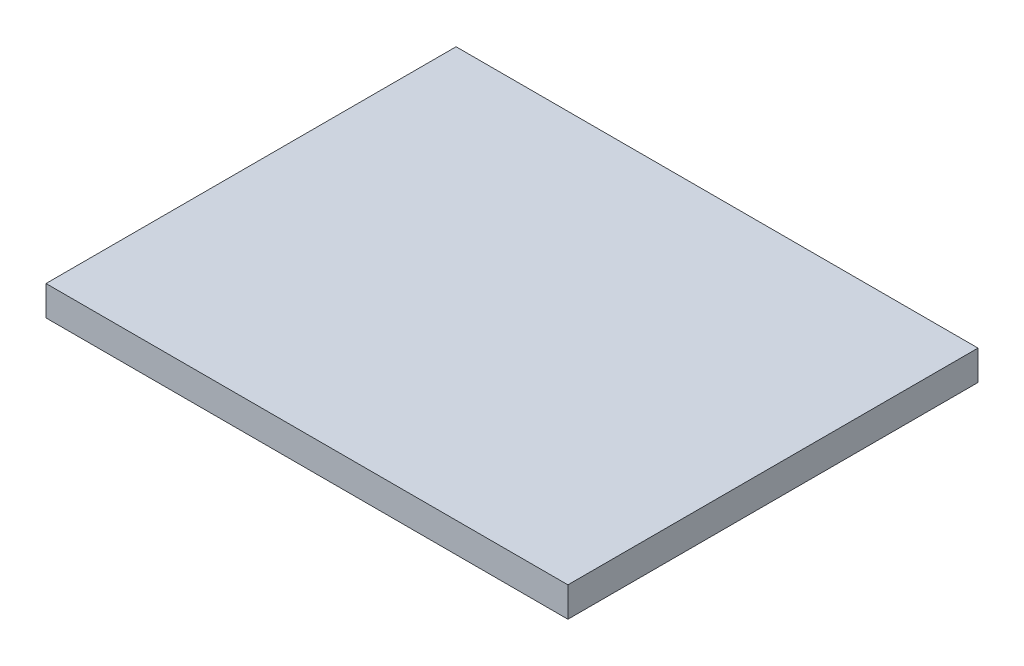
from build123d import *

# Parameters (mm, degrees)
SKETCH1_W           = 70
SKETCH1_H           = 55
BOSS_EXTRUDE1_DEPTH = 4


with BuildPart() as part:
    # Sketch1 → Boss-Extrude1 (new body)
    with BuildSketch(Plane(origin=(0, 0, 0), x_dir=(1, 0, 0), z_dir=(0, 1, 0))):
        Rectangle(SKETCH1_W, SKETCH1_H)
    extrude(amount=BOSS_EXTRUDE1_DEPTH)


solid = part.part
